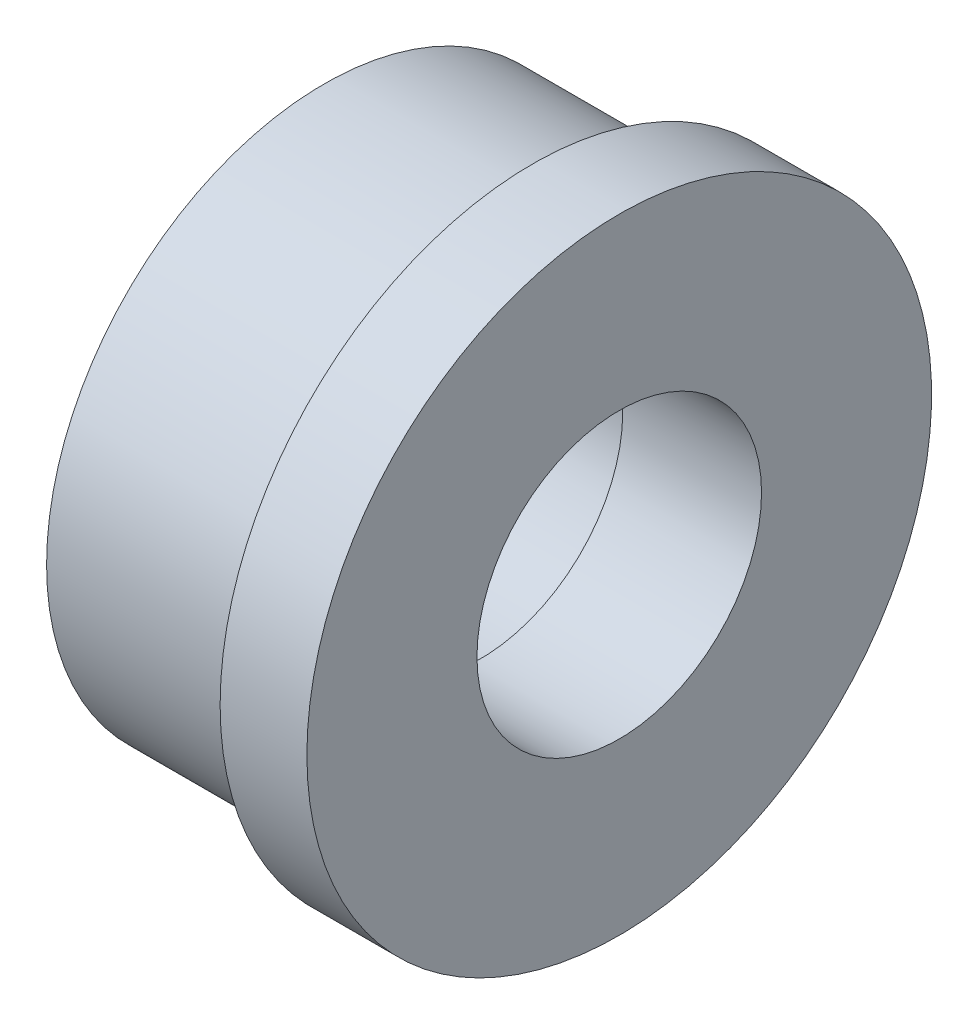
from build123d import *

# Parameters (mm, degrees)
SKETCH2_W = 6
SKETCH2_H = 1


with BuildPart() as part:
    # Sketch1 → Revolve1 (revolve)
    with BuildSketch(Plane.XY, mode=Mode.PRIVATE) as revolve1_sk:
        Polygon((-4.25, 9), (4.25, 9), (4.25, 4.1), (0.25, 4.1), (0.25, 4.15), (-4.25, 4.15), align=None)
    revolve(revolve1_sk.sketch.rotate(Axis((0, 0, 0), (1, 0, 0)), 90), axis=Axis((0, 0, 0), (1, 0, 0)))

    # Sketch2 → Cut-Revolve1 (revolve, cut)
    with BuildSketch(Plane.XY, mode=Mode.PRIVATE) as cut_revolve1_sk:
        with Locations((-1.25, 8.5)):
            Rectangle(SKETCH2_W, SKETCH2_H)
    revolve(cut_revolve1_sk.sketch.rotate(Axis((0, 0, 0), (1, 0, 0)), 90), axis=Axis((0, 0, 0), (1, 0, 0)), mode=Mode.SUBTRACT)


solid = part.part
